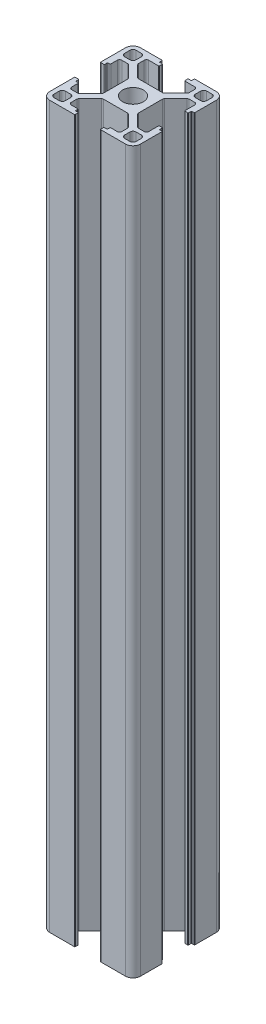
from build123d import *

# Parameters (mm, degrees)
BOSS_EXTRUDE3_START = 1
BOSS_EXTRUDE3_DEPTH = 238


with BuildPart() as part:
    # Sketch2 → Boss-Extrude3 (new body)
    with BuildSketch(Plane(origin=(0, -1630.441117946, 0), x_dir=(1, 0, 0), z_dir=(0, 1, 0)).offset(BOSS_EXTRUDE3_START)):
        with BuildLine():
            Line((-1199.016809522, 0), (-1206.016809522, 0))
            ThreePointArc((-1206.016809522, 0), (-1207.784576475, -0.732233047), (-1208.516809522, -2.5))
            Line((-1208.516809522, -2.5), (-1208.516809522, -10.6))
            ThreePointArc((-1208.516809522, -10.6), (-1208.458230878, -10.741421356), (-1208.316809522, -10.8))
            Line((-1208.316809522, -10.8), (-1207.384378664, -10.8))
            ThreePointArc((-1207.384378664, -10.8), (-1207.242957308, -10.741421356), (-1207.184378664, -10.6))
            Line((-1207.184378664, -10.6), (-1207.184378664, -9.9))
            ThreePointArc((-1207.184378664, -9.9), (-1207.12580002, -9.758578644), (-1206.984378664, -9.7))
            Line((-1206.984378664, -9.7), (-1206.516809522, -9.7))
            ThreePointArc((-1206.516809522, -9.7), (-1206.375388166, -9.641421356), (-1206.316809522, -9.5))
            Line((-1206.316809522, -9.5), (-1206.316809522, -7.4))
            ThreePointArc((-1206.316809522, -7.4), (-1206.097139608, -6.869669914), (-1205.566809522, -6.65))
            Line((-1205.566809522, -6.65), (-1203.600673754, -6.65))
            ThreePointArc((-1203.600673754, -6.65), (-1203.31366118, -6.707090351), (-1203.070343668, -6.869669914))
            Line((-1203.070343668, -6.869669914), (-1199.404048578, -10.535965005))
            ThreePointArc((-1199.404048578, -10.535965005), (-1199.241469014, -10.779282516), (-1199.184378664, -11.06629509))
            Line((-1199.184378664, -11.06629509), (-1199.184378664, -18.93370491))
            ThreePointArc((-1199.184378664, -18.93370491), (-1199.241469014, -19.220717484), (-1199.404048578, -19.464034995))
            Line((-1199.404048578, -19.464034995), (-1203.070343668, -23.130330086))
            ThreePointArc((-1203.070343668, -23.130330086), (-1203.31366118, -23.292909649), (-1203.600673754, -23.35))
            Line((-1203.600673754, -23.35), (-1205.434378664, -23.35))
            ThreePointArc((-1205.434378664, -23.35), (-1205.96470875, -23.130330086), (-1206.184378664, -22.6))
            Line((-1206.184378664, -22.6), (-1206.184378664, -20.5))
            ThreePointArc((-1206.184378664, -20.5), (-1206.242957308, -20.358578644), (-1206.384378664, -20.3))
            Line((-1206.384378664, -20.3), (-1206.984378664, -20.3))
            ThreePointArc((-1206.984378664, -20.3), (-1207.12580002, -20.241421356), (-1207.184378664, -20.1))
            Line((-1207.184378664, -20.1), (-1207.184378664, -19.4))
            ThreePointArc((-1207.184378664, -19.4), (-1207.242957308, -19.258578644), (-1207.384378664, -19.2))
            Line((-1207.384378664, -19.2), (-1208.316809522, -19.2))
            ThreePointArc((-1208.316809522, -19.2), (-1208.458230878, -19.258578644), (-1208.516809522, -19.4))
            Line((-1208.516809522, -19.4), (-1208.516809522, -27.5))
            ThreePointArc((-1208.516809522, -27.5), (-1207.784576475, -29.267766953), (-1206.016809522, -30))
            Line((-1206.016809522, -30), (-1197.916809522, -30))
            ThreePointArc((-1197.916809522, -30), (-1197.775388166, -29.941421356), (-1197.716809522, -29.8))
            Line((-1197.716809522, -29.8), (-1197.716809522, -29))
            ThreePointArc((-1197.716809522, -29), (-1197.775388166, -28.858578644), (-1197.916809522, -28.8))
            Line((-1197.916809522, -28.8), (-1198.616809522, -28.8))
            ThreePointArc((-1198.616809522, -28.8), (-1198.758230878, -28.741421356), (-1198.816809522, -28.6))
            Line((-1198.816809522, -28.6), (-1198.816809522, -28))
            ThreePointArc((-1198.816809522, -28), (-1198.875388166, -27.858578644), (-1199.016809522, -27.8))
            Line((-1199.016809522, -27.8), (-1201.116809522, -27.8))
            ThreePointArc((-1201.116809522, -27.8), (-1201.647139608, -27.580330086), (-1201.866809522, -27.05))
            Line((-1201.866809522, -27.05), (-1201.866809522, -25.21629509))
            ThreePointArc((-1201.866809522, -25.21629509), (-1201.809719171, -24.929282516), (-1201.647139608, -24.685965005))
            Line((-1201.647139608, -24.685965005), (-1197.980844518, -21.019669914))
            ThreePointArc((-1197.980844518, -21.019669914), (-1197.737527006, -20.857090351), (-1197.450514432, -20.8))
            Line((-1197.450514432, -20.8), (-1189.583104612, -20.8))
            ThreePointArc((-1189.583104612, -20.8), (-1189.296092038, -20.857090351), (-1189.052774527, -21.019669914))
            Line((-1189.052774527, -21.019669914), (-1185.386479436, -24.685965005))
            ThreePointArc((-1185.386479436, -24.685965005), (-1185.223899873, -24.929282516), (-1185.166809522, -25.21629509))
            Line((-1185.166809522, -25.21629509), (-1185.166809522, -27.05))
            ThreePointArc((-1185.166809522, -27.05), (-1185.386479436, -27.580330086), (-1185.916809522, -27.8))
            Line((-1185.916809522, -27.8), (-1188.016809522, -27.8))
            ThreePointArc((-1188.016809522, -27.8), (-1188.158230878, -27.858578644), (-1188.216809522, -28))
            Line((-1188.216809522, -28), (-1188.216809522, -28.6))
            ThreePointArc((-1188.216809522, -28.6), (-1188.275388166, -28.741421356), (-1188.416809522, -28.8))
            Line((-1188.416809522, -28.8), (-1189.116809522, -28.8))
            ThreePointArc((-1189.116809522, -28.8), (-1189.258230878, -28.858578644), (-1189.316809522, -29))
            Line((-1189.316809522, -29), (-1189.316809522, -29.8))
            ThreePointArc((-1189.316809522, -29.8), (-1189.258230878, -29.941421356), (-1189.116809522, -30))
            Line((-1189.116809522, -30), (-1181.016809522, -30))
            ThreePointArc((-1181.016809522, -30), (-1179.249042569, -29.267766953), (-1178.516809522, -27.5))
            Line((-1178.516809522, -27.5), (-1178.516809522, -20.5))
            ThreePointArc((-1178.516809522, -20.5), (-1178.575388166, -20.358578644), (-1178.716809522, -20.3))
            Line((-1178.716809522, -20.3), (-1179.316809522, -20.3))
            ThreePointArc((-1179.316809522, -20.3), (-1179.458230878, -20.241421356), (-1179.516809522, -20.1))
            Line((-1179.516809522, -20.1), (-1179.516809522, -19.4))
            ThreePointArc((-1179.516809522, -19.4), (-1179.575388166, -19.258578644), (-1179.716809522, -19.2))
            Line((-1179.716809522, -19.2), (-1180.516809522, -19.2))
            ThreePointArc((-1180.516809522, -19.2), (-1180.658230878, -19.258578644), (-1180.716809522, -19.4))
            Line((-1180.716809522, -19.4), (-1180.716809522, -22.6))
            ThreePointArc((-1180.716809522, -22.6), (-1180.936479436, -23.130330086), (-1181.466809522, -23.35))
            Line((-1181.466809522, -23.35), (-1183.300514432, -23.35))
            ThreePointArc((-1183.300514432, -23.35), (-1183.587527006, -23.292909649), (-1183.830844518, -23.130330086))
            Line((-1183.830844518, -23.130330086), (-1187.497139608, -19.464034995))
            ThreePointArc((-1187.497139608, -19.464034995), (-1187.659719171, -19.220717484), (-1187.716809522, -18.93370491))
            Line((-1187.716809522, -18.93370491), (-1187.716809522, -11.06629509))
            ThreePointArc((-1187.716809522, -11.06629509), (-1187.659719171, -10.779282516), (-1187.497139608, -10.535965005))
            Line((-1187.497139608, -10.535965005), (-1183.830844518, -6.869669914))
            ThreePointArc((-1183.830844518, -6.869669914), (-1183.587527006, -6.707090351), (-1183.300514432, -6.65))
            Line((-1183.300514432, -6.65), (-1181.466809522, -6.65))
            ThreePointArc((-1181.466809522, -6.65), (-1180.936479436, -6.869669914), (-1180.716809522, -7.4))
            Line((-1180.716809522, -7.4), (-1180.716809522, -10.6))
            ThreePointArc((-1180.716809522, -10.6), (-1180.658230878, -10.741421356), (-1180.516809522, -10.8))
            Line((-1180.516809522, -10.8), (-1179.716809522, -10.8))
            ThreePointArc((-1179.716809522, -10.8), (-1179.575388166, -10.741421356), (-1179.516809522, -10.6))
            Line((-1179.516809522, -10.6), (-1179.516809522, -9.9))
            ThreePointArc((-1179.516809522, -9.9), (-1179.458230878, -9.758578644), (-1179.316809522, -9.7))
            Line((-1179.316809522, -9.7), (-1178.716809522, -9.7))
            ThreePointArc((-1178.716809522, -9.7), (-1178.575388166, -9.641421356), (-1178.516809522, -9.5))
            Line((-1178.516809522, -9.5), (-1178.516809522, -2.5))
            ThreePointArc((-1178.516809522, -2.5), (-1179.249042569, -0.732233047), (-1181.016809522, 0))
            Line((-1181.016809522, 0), (-1188.016809522, 0))
            ThreePointArc((-1188.016809522, 0), (-1188.158230878, -0.058578644), (-1188.216809522, -0.2))
            Line((-1188.216809522, -0.2), (-1188.216809522, -0.8))
            ThreePointArc((-1188.216809522, -0.8), (-1188.275388166, -0.941421356), (-1188.416809522, -1))
            Line((-1188.416809522, -1), (-1189.116809522, -1))
            ThreePointArc((-1189.116809522, -1), (-1189.258230878, -1.058578644), (-1189.316809522, -1.2))
            Line((-1189.316809522, -1.2), (-1189.316809522, -2))
            ThreePointArc((-1189.316809522, -2), (-1189.258230878, -2.141421356), (-1189.116809522, -2.2))
            Line((-1189.116809522, -2.2), (-1185.916809522, -2.2))
            ThreePointArc((-1185.916809522, -2.2), (-1185.386479436, -2.419669914), (-1185.166809522, -2.95))
            Line((-1185.166809522, -2.95), (-1185.166809522, -4.78370491))
            ThreePointArc((-1185.166809522, -4.78370491), (-1185.223899873, -5.070717484), (-1185.386479436, -5.314034995))
            Line((-1185.386479436, -5.314034995), (-1189.052774527, -8.980330086))
            ThreePointArc((-1189.052774527, -8.980330086), (-1189.296092038, -9.142909649), (-1189.583104612, -9.2))
            Line((-1189.583104612, -9.2), (-1197.450514432, -9.2))
            ThreePointArc((-1197.450514432, -9.2), (-1197.737527006, -9.142909649), (-1197.980844518, -8.980330086))
            Line((-1197.980844518, -8.980330086), (-1201.647139608, -5.314034995))
            ThreePointArc((-1201.647139608, -5.314034995), (-1201.809719171, -5.070717484), (-1201.866809522, -4.78370491))
            Line((-1201.866809522, -4.78370491), (-1201.866809522, -2.95))
            ThreePointArc((-1201.866809522, -2.95), (-1201.647139608, -2.419669914), (-1201.116809522, -2.2))
            Line((-1201.116809522, -2.2), (-1197.916809522, -2.2))
            ThreePointArc((-1197.916809522, -2.2), (-1197.775388166, -2.141421356), (-1197.716809522, -2))
            Line((-1197.716809522, -2), (-1197.716809522, -1.2))
            ThreePointArc((-1197.716809522, -1.2), (-1197.775388166, -1.058578644), (-1197.916809522, -1))
            Line((-1197.916809522, -1), (-1198.616809522, -1))
            ThreePointArc((-1198.616809522, -1), (-1198.758230878, -0.941421356), (-1198.816809522, -0.8))
            Line((-1198.816809522, -0.8), (-1198.816809522, -0.2))
            ThreePointArc((-1198.816809522, -0.2), (-1198.875388166, -0.058578644), (-1199.016809522, 0))
        make_face()
        with BuildLine():
            Line((-1206.066809522, -28.55), (-1204.316809522, -28.55))
            ThreePointArc((-1204.316809522, -28.55), (-1203.609702741, -28.257106781), (-1203.316809522, -27.55))
            Line((-1203.316809522, -27.55), (-1203.316809522, -25.8))
            ThreePointArc((-1203.316809522, -25.8), (-1203.609702741, -25.092893219), (-1204.316809522, -24.8))
            Line((-1204.316809522, -24.8), (-1206.066809522, -24.8))
            ThreePointArc((-1206.066809522, -24.8), (-1206.773916303, -25.092893219), (-1207.066809522, -25.8))
            Line((-1207.066809522, -25.8), (-1207.066809522, -27.55))
            ThreePointArc((-1207.066809522, -27.55), (-1206.773916303, -28.257106781), (-1206.066809522, -28.55))
        make_face(mode=Mode.SUBTRACT)
        with BuildLine():
            Line((-1206.066809522, -5.2), (-1204.316809522, -5.2))
            ThreePointArc((-1204.316809522, -5.2), (-1203.609702741, -4.907106781), (-1203.316809522, -4.2))
            Line((-1203.316809522, -4.2), (-1203.316809522, -2.45))
            ThreePointArc((-1203.316809522, -2.45), (-1203.609702741, -1.742893219), (-1204.316809522, -1.45))
            Line((-1204.316809522, -1.45), (-1206.066809522, -1.45))
            ThreePointArc((-1206.066809522, -1.45), (-1206.773916303, -1.742893219), (-1207.066809522, -2.45))
            Line((-1207.066809522, -2.45), (-1207.066809522, -4.2))
            ThreePointArc((-1207.066809522, -4.2), (-1206.773916303, -4.907106781), (-1206.066809522, -5.2))
        make_face(mode=Mode.SUBTRACT)
        with BuildLine():
            Line((-1180.966809522, -24.8), (-1182.716809522, -24.8))
            ThreePointArc((-1182.716809522, -24.8), (-1183.423916303, -25.092893219), (-1183.716809522, -25.8))
            Line((-1183.716809522, -25.8), (-1183.716809522, -27.55))
            ThreePointArc((-1183.716809522, -27.55), (-1183.423916303, -28.257106781), (-1182.716809522, -28.55))
            Line((-1182.716809522, -28.55), (-1180.966809522, -28.55))
            ThreePointArc((-1180.966809522, -28.55), (-1180.259702741, -28.257106781), (-1179.966809522, -27.55))
            Line((-1179.966809522, -27.55), (-1179.966809522, -25.8))
            ThreePointArc((-1179.966809522, -25.8), (-1180.259702741, -25.092893219), (-1180.966809522, -24.8))
        make_face(mode=Mode.SUBTRACT)
        with BuildLine():
            Line((-1182.716809522, -5.2), (-1180.966809522, -5.2))
            ThreePointArc((-1180.966809522, -5.2), (-1180.259702741, -4.907106781), (-1179.966809522, -4.2))
            Line((-1179.966809522, -4.2), (-1179.966809522, -2.45))
            ThreePointArc((-1179.966809522, -2.45), (-1180.259702741, -1.742893219), (-1180.966809522, -1.45))
            Line((-1180.966809522, -1.45), (-1182.716809522, -1.45))
            ThreePointArc((-1182.716809522, -1.45), (-1183.423916303, -1.742893219), (-1183.716809522, -2.45))
            Line((-1183.716809522, -2.45), (-1183.716809522, -4.2))
            ThreePointArc((-1183.716809522, -4.2), (-1183.423916303, -4.907106781), (-1182.716809522, -5.2))
        make_face(mode=Mode.SUBTRACT)
        with BuildLine():
            ThreePointArc((-1193.516809522, -11.6), (-1196.916809522, -15), (-1193.516809522, -18.4))
            ThreePointArc((-1193.516809522, -18.4), (-1190.116809522, -15), (-1193.516809522, -11.6))
        make_face(mode=Mode.SUBTRACT)
    extrude(amount=BOSS_EXTRUDE3_DEPTH)


solid = part.part
